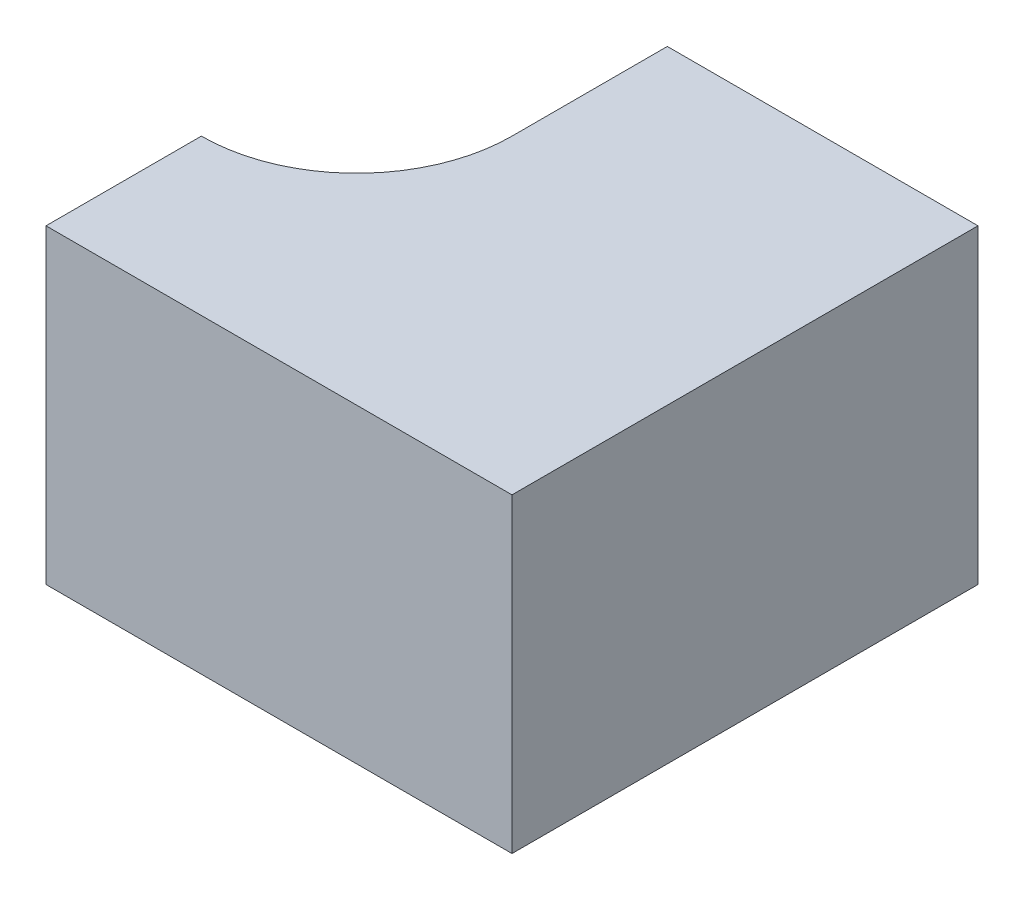
from build123d import *

# Parameters (mm, degrees)
BOSS_EXTRUDE1_DEPTH = 20


with BuildPart() as part:
    # Sketch2 → Boss-Extrude1 (new body)
    with BuildSketch(Plane(origin=(0, 0, 0), x_dir=(1, 0, 0), z_dir=(0, 1, 0))):
        with BuildLine():
            Line((0, 0), (0, -10))
            ThreePointArc((0, -10), (2.928932188, -17.071067812), (10, -20))
            Line((10, -20), (10, -30))
            Line((10, -30), (-20, -30))
            Line((-20, -30), (-20, 0))
            Line((-20, 0), (0, 0))
        make_face()
    extrude(amount=BOSS_EXTRUDE1_DEPTH)


with BuildPart() as body_2:
    # Mirror4: mirrored copy
    add(part.part.mirror(Plane(origin=(10, 20, 20), x_dir=(0, 0, 1), z_dir=(-1, 0, 0))))


solid = body_2.part
